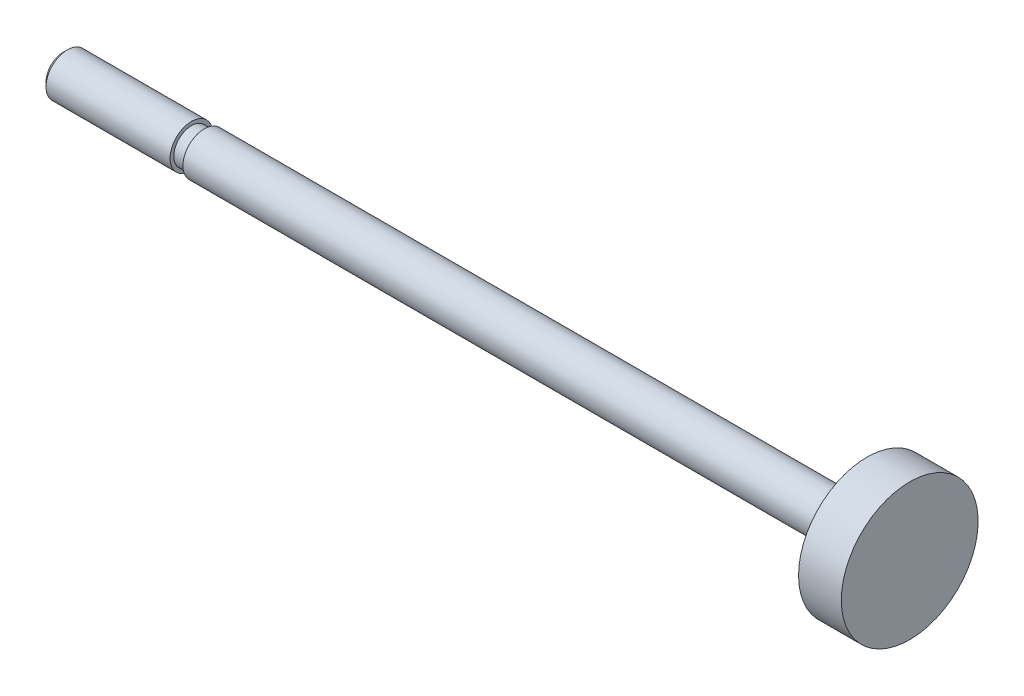
from build123d import *


with BuildPart() as part:
    # Sketch1 → Revolve1 (revolve)
    with BuildSketch(Plane.XY, mode=Mode.PRIVATE) as revolve1_sk:
        Polygon((0, 0), (0, 2.0095), (0.4905, 2.5), (15, 2.5), (15, 2.067), (16.5, 2.067), (16.5, 2.5), (94, 2.5), (94, 8), (99, 8), (99, 0), align=None)
    revolve(revolve1_sk.sketch.rotate(Axis((99, 0, 0), (-1, 0, 0)), 270), axis=Axis((99, 0, 0), (-1, 0, 0)))


solid = part.part
